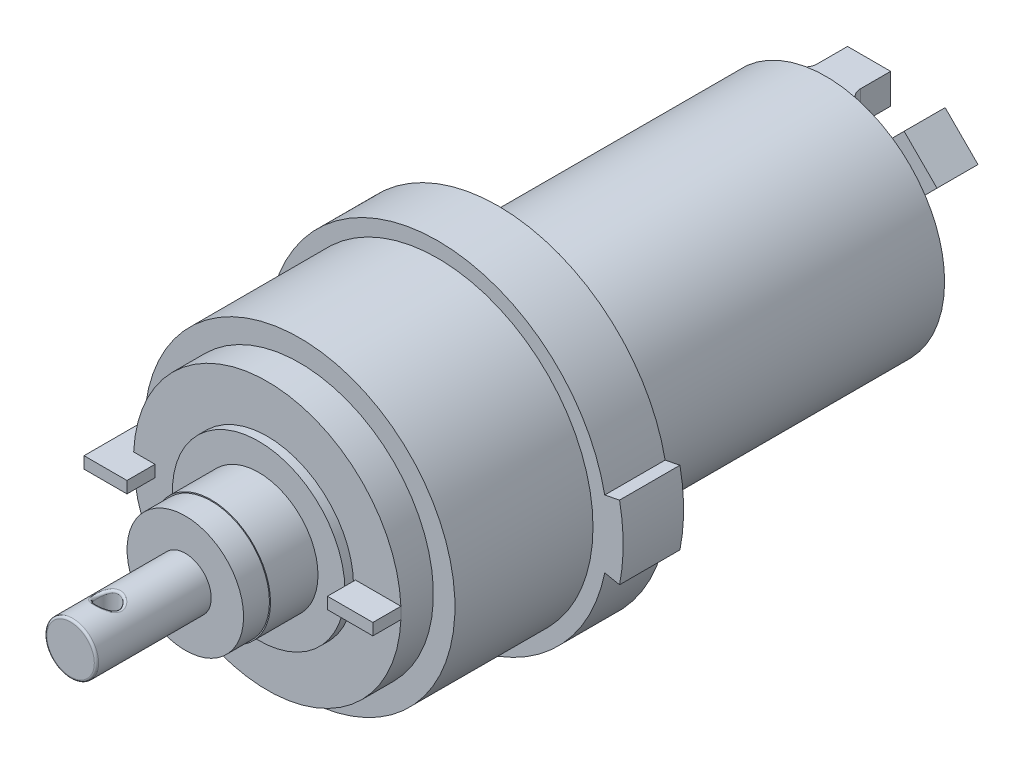
from build123d import *

# Parameters (mm, degrees)
SKETCH1_R                = 13.75
MOTORBODY_DEPTH          = 38
PLASTIC_CAP_DEPTH        = 7
SKETCH3_R                = 18
BOSS_EXTRUDE3_DEPTH      = 16
SKETCH4_R                = 15.5
BOSS_EXTRUDE4_DEPTH      = 3.75
SKETCH5_R                = 10
BOSS_EXTRUDE5_DEPTH      = 1
SKETCH6_R                = 6.875
BOSS_EXTRUDE6_DEPTH      = 5.5
SKETCH7_R                = 6.75
WASHERS_DEPTH            = 3
SKETCH8_R                = 3
SHAFT_DEPTH              = 13.3
SKETCH9_W                = 4.974619722
SKETCH9_H                = 1.351567934
SKETCH9_W_2              = 5.261651729
SQUARESSTICKINGOUT_DEPTH = 7
SKETCH10_R               = 1.25
HOLEINSHAFT_DEPTH        = 3.5
FILLET4_R                = 0.25
SKETCH11_W               = 5
SKETCH11_H               = 3.5
BOSS_EXTRUDE10_DEPTH     = 5
BOSS_EXTRUDE11_DEPTH     = 4.75
FILLET5_R                = 1.5
FILLET6_R                = 0.25


with BuildPart() as part:
    # Sketch1 → MotorBody (new body)
    with BuildSketch(Plane.XY):
        Circle(SKETCH1_R)
    extrude(amount=-MOTORBODY_DEPTH)

    # Sketch2 → Plastic Cap (add)
    with BuildSketch(Plane.XY):
        with BuildLine():
            Line((19.360287685, 3.904069767), (21.075756214, 4.25))
            ThreePointArc((21.075756214, 4.25), (21.5, 0), (21.075756214, -4.25))
            Line((21.075756214, -4.25), (19.360287685, -3.904069767))
            ThreePointArc((19.360287685, -3.904069767), (0, -19.75), (-19.360287685, -3.904069767))
            Line((-19.360287685, -3.904069767), (-21.075756214, -4.25))
            ThreePointArc((-21.075756214, -4.25), (-21.5, 0), (-21.075756214, 4.25))
            Line((-21.075756214, 4.25), (-19.360287685, 3.904069767))
            ThreePointArc((-19.360287685, 3.904069767), (0, 19.75), (19.360287685, 3.904069767))
        make_face()
    extrude(amount=PLASTIC_CAP_DEPTH)

    # Sketch3 → Boss-Extrude3 (add)
    with BuildSketch(Plane.XY.offset(7)):
        Circle(SKETCH3_R)
    extrude(amount=BOSS_EXTRUDE3_DEPTH)

    # Sketch4 → Boss-Extrude4 (add)
    with BuildSketch(Plane.XY.offset(23)):
        Circle(SKETCH4_R)
    extrude(amount=BOSS_EXTRUDE4_DEPTH)

    # Sketch5 → Boss-Extrude5 (add)
    with BuildSketch(Plane.XY.offset(26.75)):
        Circle(SKETCH5_R)
    extrude(amount=BOSS_EXTRUDE5_DEPTH)

    # Sketch6 → Boss-Extrude6 (add)
    with BuildSketch(Plane.XY.offset(27.75)):
        Circle(SKETCH6_R)
    extrude(amount=BOSS_EXTRUDE6_DEPTH)

    # Sketch7 → Washers (add)
    with BuildSketch(Plane.XY.offset(33.25)):
        Circle(SKETCH7_R)
    extrude(amount=WASHERS_DEPTH)

    # Sketch8 → Shaft (add)
    with BuildSketch(Plane.XY.offset(36.25)):
        Circle(SKETCH8_R)
    extrude(amount=SHAFT_DEPTH)

    # Sketch9 → squaresStickingOut (add)
    with BuildSketch(Plane.XY.offset(23)):
        with Locations((-15.5, 0)):
            Rectangle(SKETCH9_W, SKETCH9_H)
        with Locations((12.854435388, 0)):
            Rectangle(SKETCH9_W_2, SKETCH9_H)
    extrude(amount=SQUARESSTICKINGOUT_DEPTH)

    # Sketch10 → HoleInShaft (cut, symmetric)
    with BuildSketch(Plane(origin=(0, 0, 0), x_dir=(1, 0, 0), z_dir=(0, 1, 0))):
        with Locations(Location((0, -45.25, 0), (0, 0, 270))):
            Circle(SKETCH10_R)
    extrude(amount=HOLEINSHAFT_DEPTH, both=True, mode=Mode.SUBTRACT)

    # Fillet4
    fillet4_edges = [part.edges().sort_by_distance(p)[0] for p in [
        (-3, 0, 49.55),
    ]]
    fillet(fillet4_edges, radius=FILLET4_R)

    # Sketch11 → Boss-Extrude10 (add)
    with BuildSketch(Plane(origin=(0, 0, -38), x_dir=(-1, 0, 0), z_dir=(0, 0, -1))):
        with Locations((0, 11.249220301)):
            Rectangle(SKETCH11_W, SKETCH11_H)
        with Locations((0, -11.249220301)):
            Rectangle(SKETCH11_W, SKETCH11_H)
    extrude(amount=BOSS_EXTRUDE10_DEPTH)

    # Sketch12 → Boss-Extrude11 (add)
    with BuildSketch(Plane(origin=(0, 0, -38), x_dir=(-1, 0, 0), z_dir=(0, 0, -1))):
        Polygon((-12.871526584, 8.95434373), (-7.002493214, 3.085310359), (-3.192342903, 6.89546067), (-9.061376273, 12.764494041), align=None)
    extrude(amount=BOSS_EXTRUDE11_DEPTH)

    # Fillet5
    fillet5_edges = [part.edges().sort_by_distance(p)[0] for p in [
        (-2.5, 11.249220301, -38),
        (2.5, 11.249220301, -38),
        (0, 9.499220301, -38),
        (-2.5, -11.249220301, -38),
        (0, -9.499220301, -38),
        (2.5, -11.249220301, -38),
    ]]
    fillet(fillet5_edges, radius=FILLET5_R)

    # Fillet6
    fillet6_edges = [part.edges().sort_by_distance(p)[0] for p in [
        (4e-09, 3.000000001, 44.000000001),
        (4e-09, -3.000000001, 44.000000001),
    ]]
    fillet(fillet6_edges, radius=FILLET6_R)


solid = part.part
